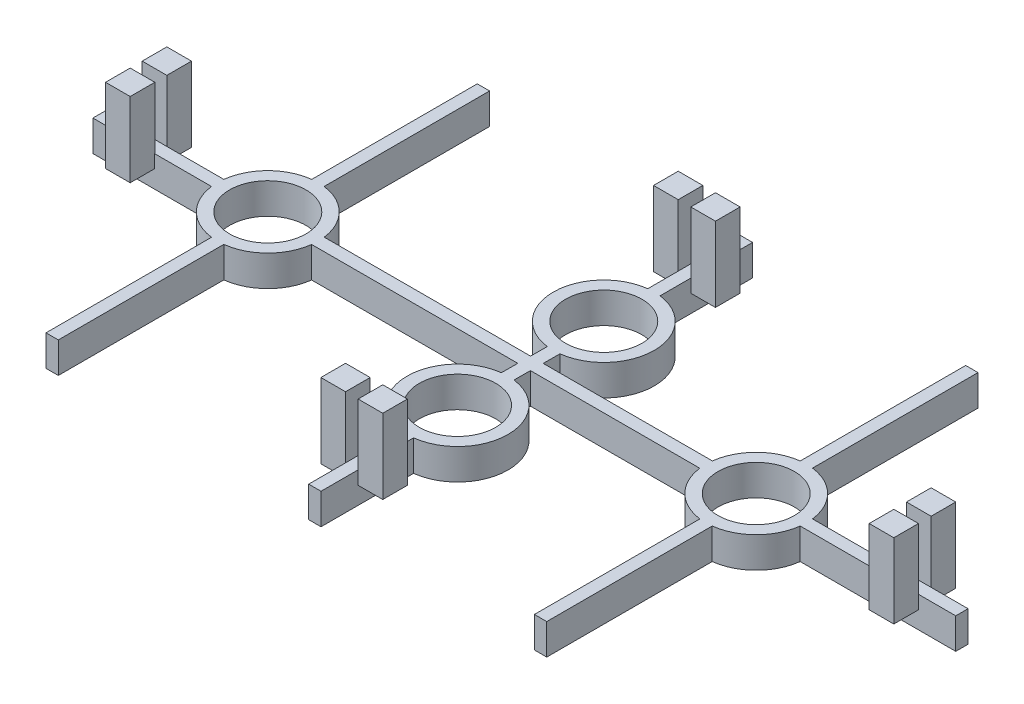
from build123d import *

# Parameters (mm, degrees)
SKETCH2_R                = 6.2
BOSS_EXTRUDE1_DEPTH      = 5
BOSS_EXTRUDE2_DEPTH      = 10
BOSS_EXTRUDE2_DEPTH_BACK = 2.132247663
SKETCH4_W                = 4
SKETCH4_H                = 4


with BuildPart() as part:
    # Sketch2 → Boss-Extrude1 (new body)
    with BuildSketch(Plane(origin=(0, 0, 0), x_dir=(1, 0, 0), z_dir=(0, 1, 0))):
        with BuildLine():
            Line((1.018110987, -1.021808769), (28.477746067, -1))
            ThreePointArc((28.477746067, -1), (30.824069579, -5.782175759), (35.613431348, -8.11379598))
            Line((35.613431348, -8.11379598), (35.613431348, -34.975))
            Line((35.613431348, -34.975), (37.613431348, -34.975))
            Line((37.613431348, -34.975), (37.613431348, -8.11379598))
            ThreePointArc((37.613431348, -8.11379598), (42.411706954, -5.773275606), (44.752227328, -0.975))
            Line((44.752227328, -0.975), (70, -0.975))
            Line((70, -0.975), (70, 1.025))
            Line((70, 1.025), (44.752227328, 1.025))
            ThreePointArc((44.752227328, 1.025), (42.411706954, 5.823275606), (37.613431348, 8.16379598))
            Line((37.613431348, 8.16379598), (37.613431348, 35.025))
            Line((37.613431348, 35.025), (35.613431348, 35.025))
            Line((35.613431348, 35.025), (35.613431348, 8.16379598))
            ThreePointArc((35.613431348, 8.16379598), (30.824069579, 5.832175759), (28.477746067, 1.05))
            Line((28.477746067, 1.05), (1.031761634, 1.028202073))
            Line((1.031761634, 1.028202073), (1.049782331, 3.73449335))
            ThreePointArc((1.049782331, 3.73449335), (8.224089635, 11.883378989), (1.023413071, 20.008973088))
            Line((1.023413071, 20.008973088), (1.023413071, 35.025))
            Line((1.023413071, 35.025), (-0.976586929, 35.025))
            Line((-0.976586929, 35.025), (-0.976586929, 20.008804187))
            ThreePointArc((-0.976586929, 20.008804187), (-8.175890957, 11.881999168), (-1.000217662, 3.734321519))
            Line((-1.000217662, 3.734321519), (-1.018248057, 1.026573931))
            Line((-1.018248057, 1.026573931), (-34.477746067, 1))
            ThreePointArc((-34.477746067, 1), (-36.824069579, 5.782175759), (-41.613431348, 8.11379598))
            Line((-41.613431348, 8.11379598), (-41.613431348, 34.975))
            Line((-41.613431348, 34.975), (-43.613431348, 34.975))
            Line((-43.613431348, 34.975), (-43.613431348, 8.11379598))
            ThreePointArc((-43.613431348, 8.11379598), (-48.411706954, 5.773275606), (-50.752227328, 0.975))
            Line((-50.752227328, 0.975), (-70, 0.975))
            Line((-70, 0.975), (-70, -1.025))
            Line((-70, -1.025), (-50.752227328, -1.025))
            ThreePointArc((-50.752227328, -1.025), (-48.411706954, -5.823275606), (-43.613431348, -8.16379598))
            Line((-43.613431348, -8.16379598), (-43.613431348, -35.025))
            Line((-43.613431348, -35.025), (-41.613431348, -35.025))
            Line((-41.613431348, -35.025), (-41.613431348, -8.16379598))
            ThreePointArc((-41.613431348, -8.16379598), (-36.824069579, -5.832175759), (-34.477746067, -1.05))
            Line((-34.477746067, -1.05), (-1.031898703, -1.023436911))
            Line((-1.031898703, -1.023436911), (-1.049596092, -3.68117478))
            ThreePointArc((-1.049596092, -3.68117478), (-8.223903396, -11.830060419), (-1.023226832, -19.955654518))
            Line((-1.023226832, -19.955654518), (-1.023226832, -34.975))
            Line((-1.023226832, -34.975), (0.976773168, -34.975))
            Line((0.976773168, -34.975), (0.976773168, -19.955485617))
            ThreePointArc((0.976773168, -19.955485617), (8.176077196, -11.828680597), (1.000403901, -3.681002948))
            Line((1.000403901, -3.681002948), (1.018110987, -1.021808769))
        make_face()
        with Locations(Location((-42.613431348, -0.025, 0), (0, 0, 270))):
            Circle(SKETCH2_R, mode=Mode.SUBTRACT)
        with Locations(Location((0.024100398, 11.870092687, 0), (0, 0, 270))):
            Circle(SKETCH2_R, mode=Mode.SUBTRACT)
        with Locations(Location((36.613431348, 0.025, 0), (0, 0, 270))):
            Circle(SKETCH2_R, mode=Mode.SUBTRACT)
        with Locations(Location((-0.023914159, -11.816774117, 0), (0, 0, 270))):
            Circle(SKETCH2_R, mode=Mode.SUBTRACT)
    extrude(amount=BOSS_EXTRUDE1_DEPTH)

    # Sketch4 → Boss-Extrude2 (add, two sides: drawn at the far end of the back side and taken through both)
    with BuildSketch(Plane(origin=(0, 5, 0), x_dir=(1, 0, 0), z_dir=(0, 1, 0)).offset(-BOSS_EXTRUDE2_DEPTH_BACK)):
        with Locations((3.023413071, 27)):
            Rectangle(SKETCH4_W, SKETCH4_H)
        with Locations((-62, 2.975)):
            Rectangle(SKETCH4_W, SKETCH4_H)
        with Locations((62, 3.025)):
            Rectangle(SKETCH4_W, SKETCH4_H)
        with Locations((62, -3.025)):
            Rectangle(SKETCH4_W, SKETCH4_H)
        with Locations((-3.023413071, 27)):
            Rectangle(SKETCH4_W, SKETCH4_H)
        with Locations((3.023413071, -27)):
            Rectangle(SKETCH4_W, SKETCH4_H)
        with Locations((-3.023413071, -27)):
            Rectangle(SKETCH4_W, SKETCH4_H)
        with Locations((-62, -2.975)):
            Rectangle(SKETCH4_W, SKETCH4_H)
    extrude(amount=BOSS_EXTRUDE2_DEPTH + BOSS_EXTRUDE2_DEPTH_BACK)


with BuildPart() as boss_extrude2_piece_1:
    # of the separate pieces the step leaves, piece 1, a body of its own (boss_extrude2_pieces)
    add(part.part.solids().sort_by_distance((-34.477746067, 0, 1.05))[0])


with BuildPart() as boss_extrude2_piece_2:
    # of the separate pieces the step leaves, piece 2, a body of its own (boss_extrude2_pieces)
    add(part.part.solids().sort_by_distance((64, 15, 5.025))[0])


with BuildPart() as boss_extrude2_piece_3:
    # of the separate pieces the step leaves, piece 3, a body of its own (boss_extrude2_pieces)
    add(part.part.solids().sort_by_distance((-1.023413071, 15, 29))[0])


with BuildPart() as boss_extrude2_piece_4:
    # of the separate pieces the step leaves, piece 4, a body of its own (boss_extrude2_pieces)
    add(part.part.solids().sort_by_distance((-1.023413071, 15, -25))[0])


with BuildPart() as boss_extrude2_piece_5:
    # of the separate pieces the step leaves, piece 5, a body of its own (boss_extrude2_pieces)
    add(part.part.solids().sort_by_distance((1.023413071, 15, 25))[0])


solid = Compound([boss_extrude2_piece_1.part, boss_extrude2_piece_2.part, boss_extrude2_piece_3.part, boss_extrude2_piece_4.part, boss_extrude2_piece_5.part])
